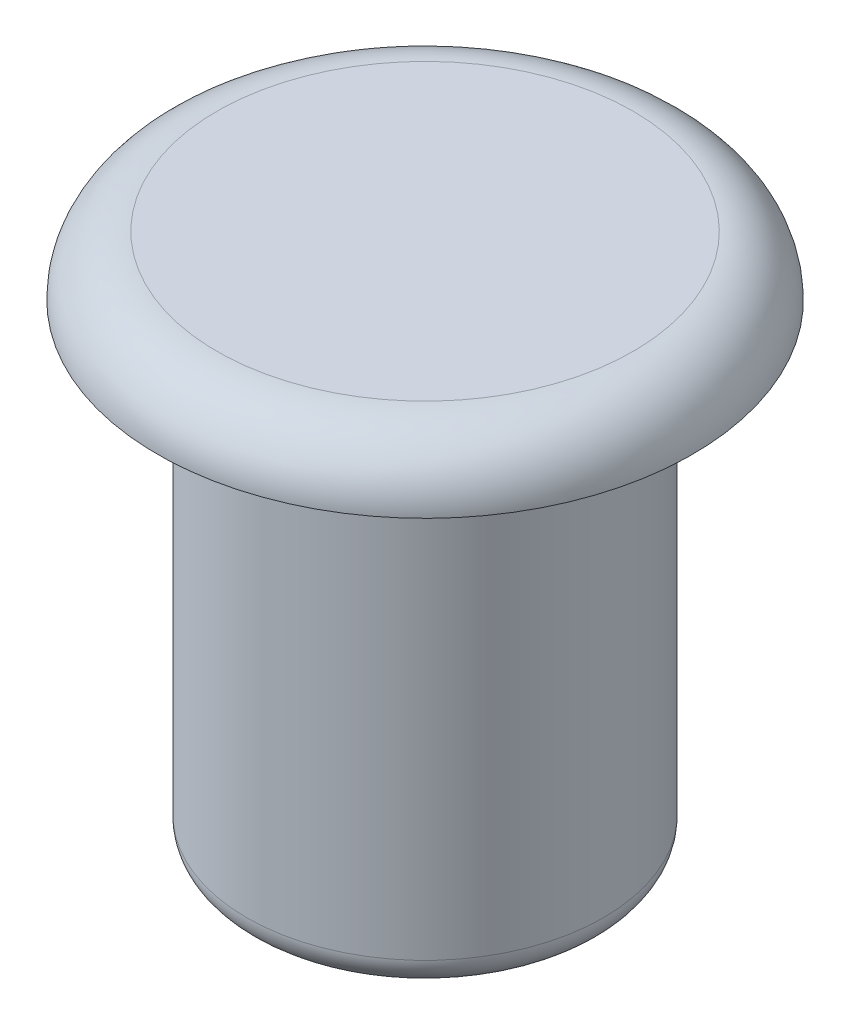
from build123d import *


with BuildPart() as part:
    # Esboço1 → Revolução1 (revolve)
    with BuildSketch(Plane(origin=(0, 0, 0), x_dir=(0, 0, -1), z_dir=(1, 0, 0)), mode=Mode.PRIVATE) as revolu_o1_sk:
        with BuildLine():
            Line((0, 9), (-3.5, 9))
            ThreePointArc((-3.5, 9), (-4.207106781, 8.707106781), (-4.5, 8))
            Line((-4.5, 8), (-3, 8))
            Line((-3, 8), (-3, 0.5))
            ThreePointArc((-3, 0.5), (-2.853553391, 0.146446609), (-2.5, 0))
            Line((-2.5, 0), (0, 0))
            Line((0, 0), (0, 9))
        make_face()
    revolve(revolu_o1_sk.sketch.rotate(Axis((0, 0, 0), (0, 1, 0)), 180), axis=Axis((0, 0, 0), (0, 1, 0)))


solid = part.part
